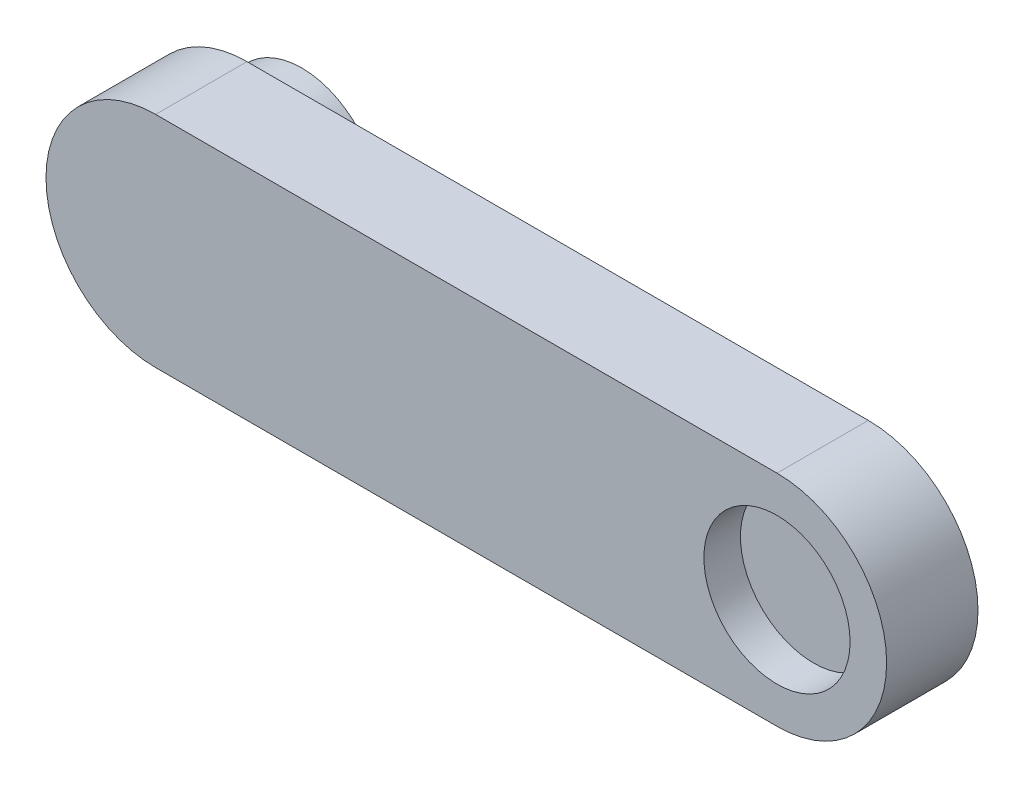
from build123d import *

# Parameters (mm, degrees)
SALIENTE_EXTRUIR1_DEPTH = 25
CROQUIS3_R              = 21
SALIENTE_EXTRUIR2_DEPTH = 15
CROQUIS4_R              = 20
CORTAR_EXTRUIR1_DEPTH   = 10


with BuildPart() as part:
    # Croquis2 → Saliente-Extruir1 (new body)
    with BuildSketch(Plane.XY):
        with BuildLine():
            Line((-85, 30), (85, 30))
            ThreePointArc((85, 30), (115, 0), (85, -30))
            Line((85, -30), (-85, -30))
            ThreePointArc((-85, -30), (-115, 0), (-85, 30))
        make_face()
    extrude(amount=SALIENTE_EXTRUIR1_DEPTH)

    # Croquis3 → Saliente-Extruir2 (add)
    with BuildSketch(Plane(origin=(0, 0, 0), x_dir=(-1, 0, 0), z_dir=(0, 0, -1))):
        with Locations(Location((85, 0, 0), (0, 0, 180))):
            Circle(CROQUIS3_R)
    extrude(amount=SALIENTE_EXTRUIR2_DEPTH)

    # Croquis4 → Cortar-Extruir1 (cut)
    with BuildSketch(Plane.XY.offset(25)):
        with Locations((85, 0)):
            Circle(CROQUIS4_R)
    extrude(amount=-CORTAR_EXTRUIR1_DEPTH, mode=Mode.SUBTRACT)


solid = part.part
